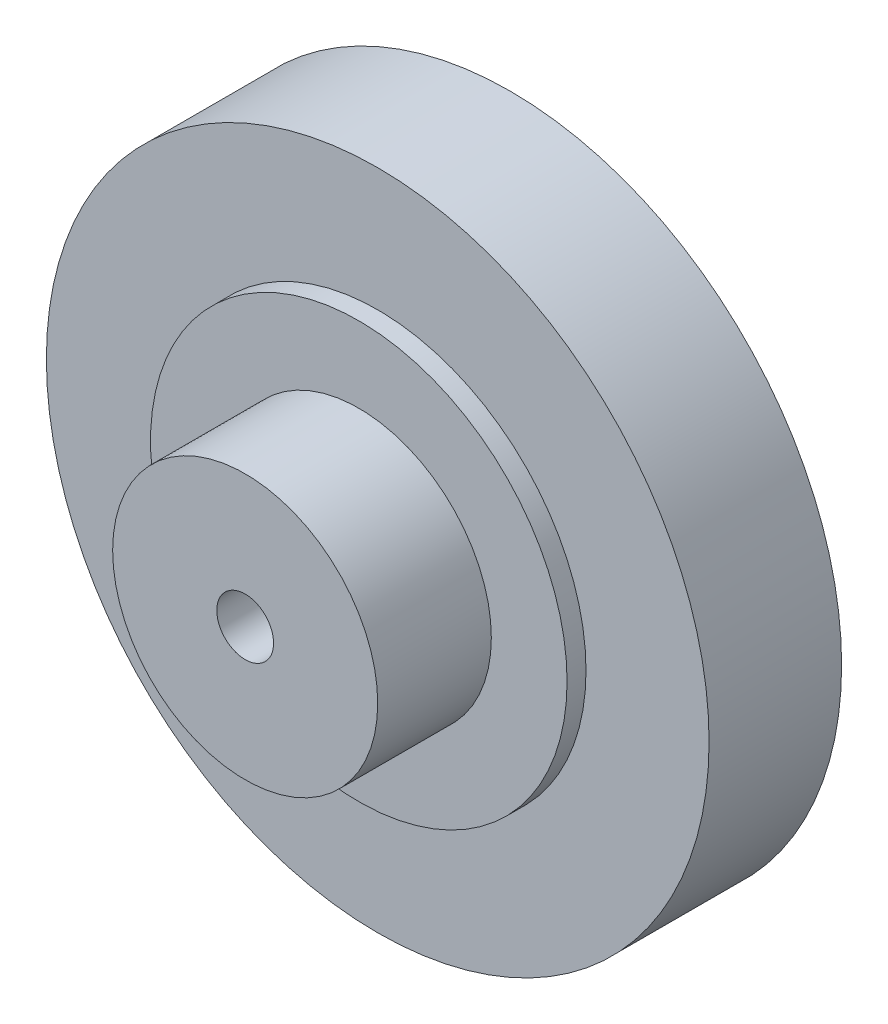
from build123d import *

# Parameters (mm, degrees)
BOSS_EXTRU_1_DEPTH      = 7
BOSS_EXTRU_1_DEPTH_BACK = 7
ESQUISSE1_R             = 35
ESQUISSE2_R             = 22
BOSS_EXTRU_2_DEPTH      = 2
BOSS_EXTRU_3_START      = 2
ESQUISSE3_R             = 22
BOSS_EXTRU_3_DEPTH      = 2
ESQUISSE4_R             = 14
BOSS_EXTRU_4_DEPTH      = 12
ESQUISSE5_R             = 3
ENL_V_MAT_EXTRU_1_DEPTH = 59


with BuildPart() as part:
    # Esquisse1 → Boss.-Extru.1 (new, two sides: drawn at the far end of the back side and taken through both)
    with BuildSketch(Plane.XY.offset(-BOSS_EXTRU_1_DEPTH_BACK)):
        Circle(ESQUISSE1_R)
    extrude(amount=BOSS_EXTRU_1_DEPTH + BOSS_EXTRU_1_DEPTH_BACK)

    # Esquisse2 → Boss.-Extru.2 (add)
    with BuildSketch(Plane.XY.offset(7)):
        Circle(ESQUISSE2_R)
    extrude(amount=BOSS_EXTRU_2_DEPTH)

    # Esquisse3 → Boss.-Extru.3 (add)
    with BuildSketch(Plane(origin=(0, 0, -7), x_dir=(-1, 0, 0), z_dir=(0, 0, -1)).offset(BOSS_EXTRU_3_START)):
        Circle(ESQUISSE3_R)
    extrude(amount=-BOSS_EXTRU_3_DEPTH)

    # Esquisse4 → Boss.-Extru.4 (add)
    with BuildSketch(Plane.XY.offset(9)):
        Circle(ESQUISSE4_R)
    extrude(amount=BOSS_EXTRU_4_DEPTH)

    # Esquisse5 → Enlèv. mat.-Extru.1 (cut)
    with BuildSketch(Plane(origin=(0, 0, -9), x_dir=(-1, 0, 0), z_dir=(0, 0, -1))):
        Circle(ESQUISSE5_R)
    extrude(amount=-ENL_V_MAT_EXTRU_1_DEPTH, mode=Mode.SUBTRACT)


solid = part.part
